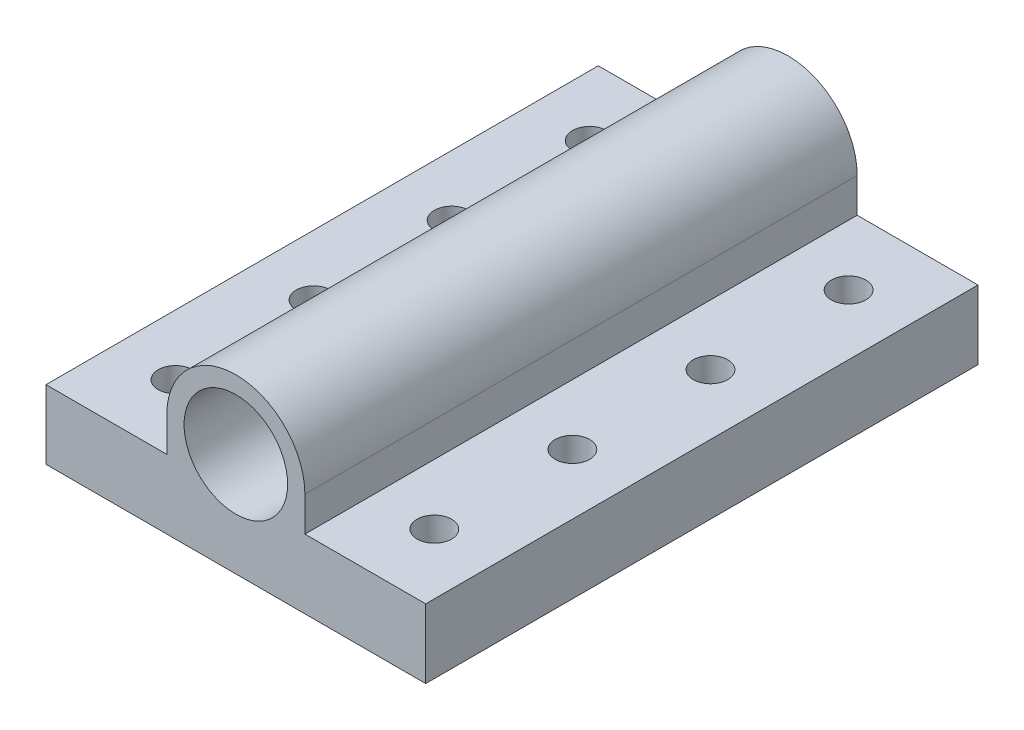
from build123d import *

# Parameters (mm, degrees)
SKETCH1_R           = 7.5
BOSS_EXTRUDE2_DEPTH = 80
SKETCH3_R           = 2.5
CUT_EXTRUDE1_DEPTH  = 2000


with BuildPart() as part:
    # Sketch1 → Boss-Extrude2 (new body)
    with BuildSketch(Plane.XY):
        with BuildLine():
            Line((0, 0), (-17.5, 0))
            Line((-17.5, 0), (-17.5, 5))
            ThreePointArc((-17.5, 5), (-27.5, 15), (-37.5, 5))
            Line((-37.5, 5), (-37.5, 0))
            Line((-37.5, 0), (-55, 0))
            Line((-55, 0), (-55, -10))
            Line((-55, -10), (0, -10))
            Line((0, -10), (0, 0))
        make_face()
        with Locations((-27.5, 5)):
            Circle(SKETCH1_R, mode=Mode.SUBTRACT)
    extrude(amount=BOSS_EXTRUDE2_DEPTH)

    # Sketch3 → Cut-Extrude1 (cut)
    with BuildSketch(Plane(origin=(0, 0, 0), x_dir=(1, 0, 0), z_dir=(0, 1, 0))):
        with Locations(Location((-8.75, -10, 0), (0, 0, 270))):
            Circle(SKETCH3_R)
        with Locations(Location((-8.75, -30, 0), (0, 0, 270))):
            Circle(SKETCH3_R)
        with Locations(Location((-8.75, -50, 0), (0, 0, 270))):
            Circle(SKETCH3_R)
        with Locations(Location((-8.75, -70, 0), (0, 0, 270))):
            Circle(SKETCH3_R)
        with Locations(Location((-46.25, -70, 0), (0, 0, 180))):
            Circle(SKETCH3_R)
        with Locations(Location((-46.25, -50, 0), (0, 0, 180))):
            Circle(SKETCH3_R)
        with Locations(Location((-46.25, -30, 0), (0, 0, 180))):
            Circle(SKETCH3_R)
        with Locations(Location((-46.25, -10, 0), (0, 0, 180))):
            Circle(SKETCH3_R)
    extrude(amount=-CUT_EXTRUDE1_DEPTH, mode=Mode.SUBTRACT)


solid = part.part
